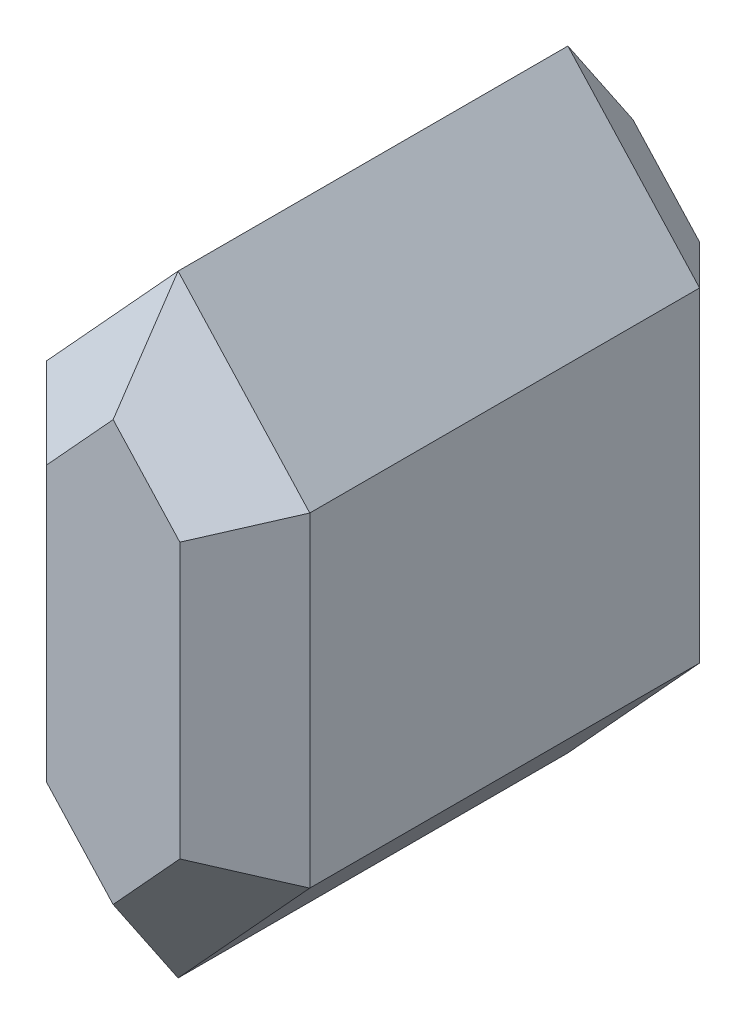
from build123d import *

# Parameters (mm, degrees)
BOSS_EXTRUDE1_DEPTH = 16
CHAMFER1_SIZE       = 2
SCALE2_SCALE        = 0.95


with BuildPart() as part:
    # Sketch1 → Boss-Extrude1 (new body)
    with BuildSketch(Plane.XY):
        Polygon((0, 18.847328042), (-4.053541246, 14.423664021), (-4.053541246, 4.423664021), (0, 0), (4.053541246, 4.423664021), (4.053541246, 14.423664021), align=None)
    extrude(amount=BOSS_EXTRUDE1_DEPTH)

    # Chamfer1
    chamfer1_edges = [part.edges().sort_by_distance(p)[0] for p in [
        (2.026770623, 16.635496031, 16),
        (-2.026770623, 16.635496031, 16),
        (-4.053541246, 9.423664021, 16),
        (-2.026770623, 2.21183201, 16),
        (2.026770623, 2.21183201, 16),
        (-2.026770623, 2.21183201, 0),
        (-4.053541246, 9.423664021, 0),
        (-2.026770623, 16.635496031, 0),
        (2.026770623, 16.635496031, 0),
        (4.053541246, 9.423664021, 0),
        (2.026770623, 2.21183201, 0),
        (4.053541246, 9.423664021, 16),
    ]]
    chamfer(chamfer1_edges, length=CHAMFER1_SIZE)


with BuildPart() as part_1:
    # Scale2: scaled about (0, 0, 0)
    add(part.part.scale(SCALE2_SCALE))


solid = part_1.part
